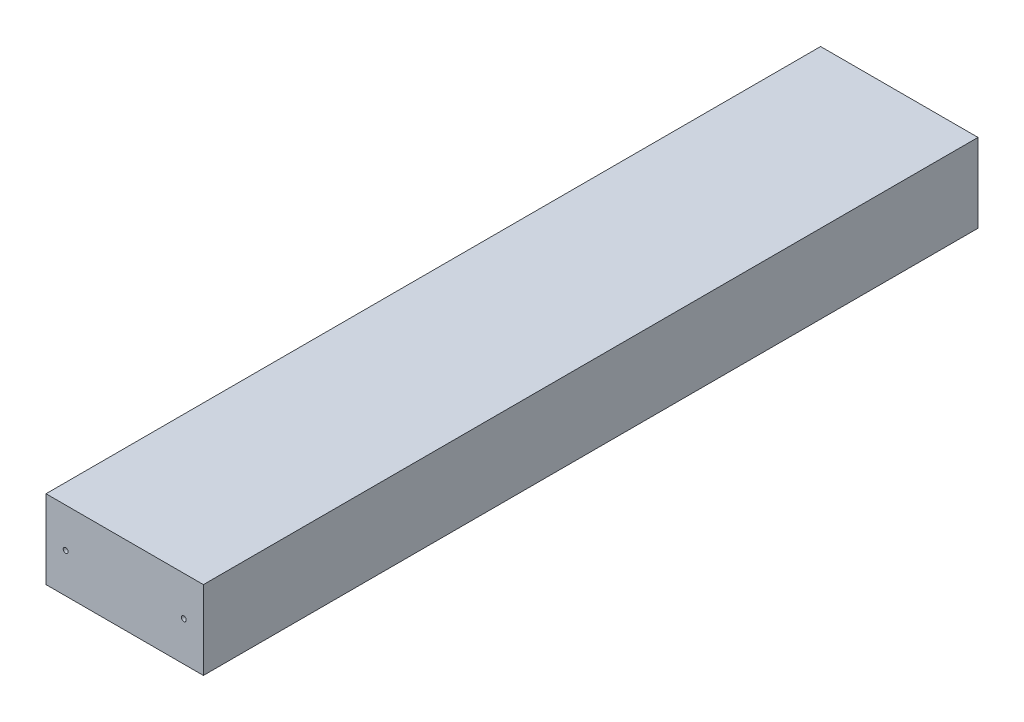
from build123d import *

# Parameters (mm, degrees)
SKETCH1_W           = 101.6
SKETCH1_H           = 50.8
BOSS_EXTRUDE1_DEPTH = 500
SKETCH2_R           = 1.5875
CUT_EXTRUDE1_DEPTH  = 44.45


with BuildPart() as part:
    # Sketch1 → Boss-Extrude1 (new body)
    with BuildSketch(Plane.XY):
        Rectangle(SKETCH1_W, SKETCH1_H)
    extrude(amount=BOSS_EXTRUDE1_DEPTH)

    # Sketch2 → Cut-Extrude1 (cut)
    with BuildSketch(Plane.XY.offset(500)):
        with Locations((-38.1, 0)):
            Circle(SKETCH2_R)
        with Locations((38.1, 0)):
            Circle(SKETCH2_R)
    cut_extrude1 = extrude(amount=-CUT_EXTRUDE1_DEPTH, mode=Mode.SUBTRACT)

    # Mirror1: Cut-Extrude1 across plane
    add(cut_extrude1.mirror(Plane(origin=(0, 0, 250), x_dir=(1, 0, 0), z_dir=(0, 0, -1))), mode=Mode.SUBTRACT)


solid = part.part
